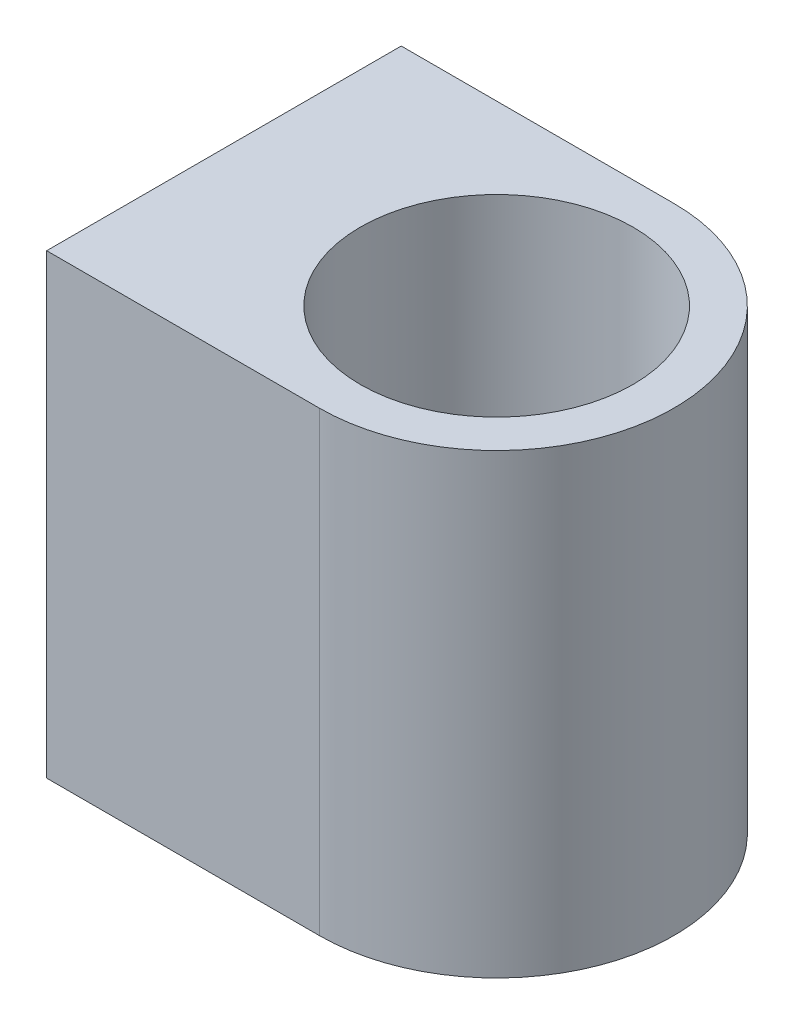
from build123d import *

# Parameters (mm, degrees)
BOSS_EXTRUDE2_DEPTH = 33.5
SKETCH2_R           = 10
CUT_EXTRUDE1_DEPTH  = 49.787805854


with BuildPart() as part:
    # Sketch1 → Boss-Extrude2 (new body)
    with BuildSketch(Plane(origin=(0, 0, 0), x_dir=(1, 0, 0), z_dir=(0, 1, 0))):
        with BuildLine():
            Line((0, 0), (0, 13))
            Line((0, 13), (20, 13))
            ThreePointArc((20, 13), (33, 0), (20, -13))
            Line((20, -13), (0, -13))
            Line((0, -13), (0, 0))
        make_face()
    extrude(amount=-BOSS_EXTRUDE2_DEPTH)

    # Sketch2 → Cut-Extrude1 (cut, through all)
    with BuildSketch(Plane(origin=(0, 0, 0), x_dir=(1, 0, 0), z_dir=(0, 1, 0))):
        with Locations(Location((20, 0, 0), (0, 0, 270))):
            Circle(SKETCH2_R)
    extrude(amount=-CUT_EXTRUDE1_DEPTH, mode=Mode.SUBTRACT)


solid = part.part
